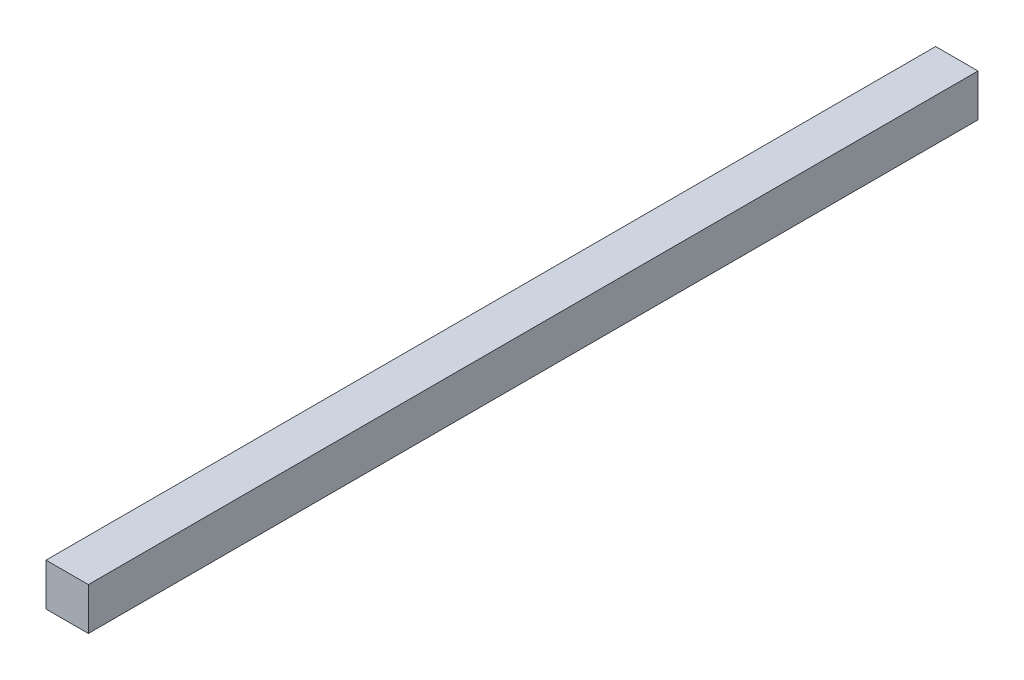
from build123d import *

# Parameters (mm, degrees)
SKETCH1_W           = 2.54
SKETCH1_H           = 2.54
BOSS_EXTRUDE1_DEPTH = 53.34


with BuildPart() as part:
    # Sketch1 → Boss-Extrude1 (new body)
    with BuildSketch(Plane.XY):
        with Locations((-1.27, 1.27)):
            Rectangle(SKETCH1_W, SKETCH1_H)
    extrude(amount=BOSS_EXTRUDE1_DEPTH)


solid = part.part
